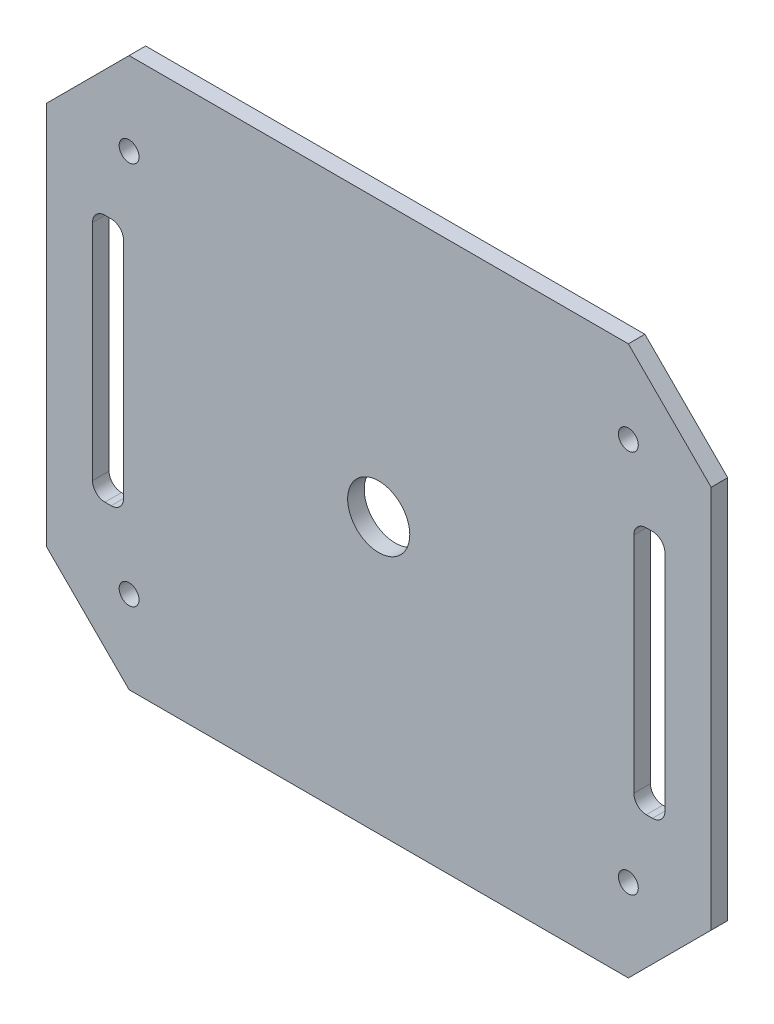
from build123d import *

# Parameters (mm, degrees)
SKETCH1_R           = 1.8
SKETCH1_R_2         = 5.625
BOSS_EXTRUDE1_DEPTH = 3


with BuildPart() as part:
    # Sketch1 → Boss-Extrude1 (new body)
    with BuildSketch(Plane.XY):
        Polygon((-14.83573824, -38.075565591), (0.16426176, -23.075565591), (90.58826176, -23.075565591), (105.58826176, -38.075565591), (105.58826176, -107.544565591), (90.58826176, -122.544565591), (0.16426176, -122.544565591), (-14.83573824, -107.544565591), align=None)
        with Locations((0.16426176, -38.075565591)):
            Circle(SKETCH1_R, mode=Mode.SUBTRACT)
        with Locations((90.58826176, -38.075565591)):
            Circle(SKETCH1_R, mode=Mode.SUBTRACT)
        with Locations((90.58826176, -107.544565591)):
            Circle(SKETCH1_R, mode=Mode.SUBTRACT)
        with Locations((0.16426176, -107.544565591)):
            Circle(SKETCH1_R, mode=Mode.SUBTRACT)
        with Locations((45.37626176, -72.810065591)):
            Circle(SKETCH1_R_2, mode=Mode.SUBTRACT)
        with BuildLine():
            Line((-4.21073824, -50.310065591), (-3.08573824, -50.310065591))
            ThreePointArc((-3.08573824, -50.310065591), (-1.494747982, -50.969075333), (-0.83573824, -52.560065591))
            Line((-0.83573824, -52.560065591), (-0.83573824, -93.060065591))
            ThreePointArc((-0.83573824, -93.060065591), (-1.494747982, -94.651055848), (-3.08573824, -95.310065591))
            Line((-3.08573824, -95.310065591), (-4.21073824, -95.310065591))
            ThreePointArc((-4.21073824, -95.310065591), (-5.801728498, -94.651055848), (-6.46073824, -93.060065591))
            Line((-6.46073824, -93.060065591), (-6.46073824, -52.560065591))
            ThreePointArc((-6.46073824, -52.560065591), (-5.801728498, -50.969075333), (-4.21073824, -50.310065591))
        make_face(mode=Mode.SUBTRACT)
        with BuildLine():
            Line((94.96326176, -50.310065591), (93.83826176, -50.310065591))
            ThreePointArc((93.83826176, -50.310065591), (92.247271502, -50.969075333), (91.58826176, -52.560065591))
            Line((91.58826176, -52.560065591), (91.58826176, -93.060065591))
            ThreePointArc((91.58826176, -93.060065591), (92.247271502, -94.651055848), (93.83826176, -95.310065591))
            Line((93.83826176, -95.310065591), (94.96326176, -95.310065591))
            ThreePointArc((94.96326176, -95.310065591), (96.554252018, -94.651055848), (97.21326176, -93.060065591))
            Line((97.21326176, -93.060065591), (97.21326176, -52.560065591))
            ThreePointArc((97.21326176, -52.560065591), (96.554252018, -50.969075333), (94.96326176, -50.310065591))
        make_face(mode=Mode.SUBTRACT)
    extrude(amount=BOSS_EXTRUDE1_DEPTH)


solid = part.part
